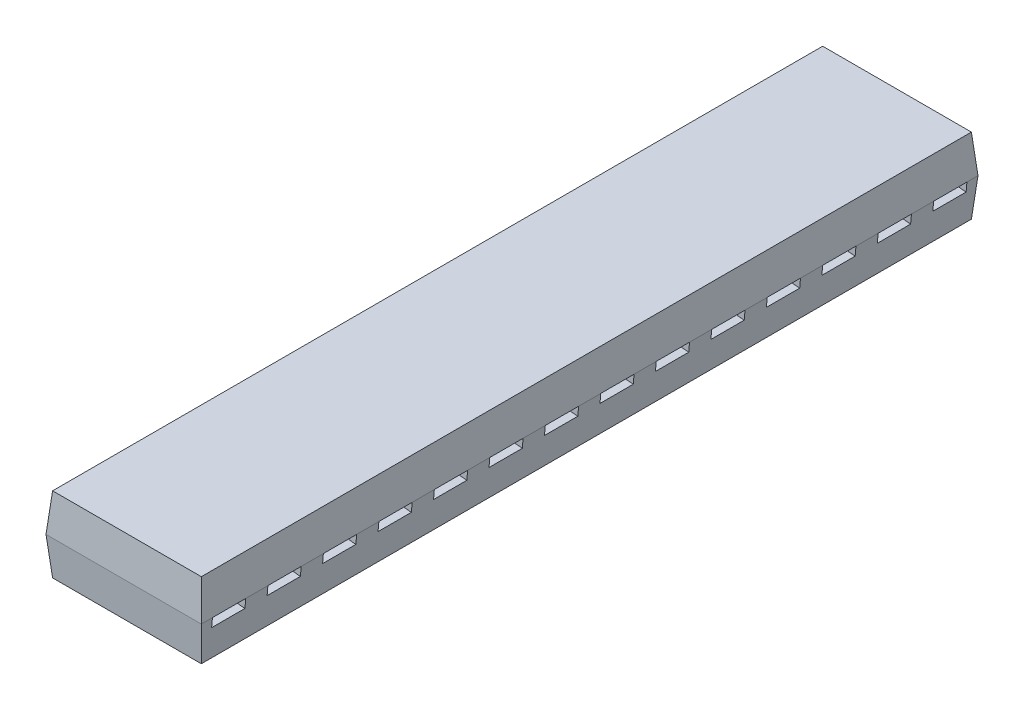
from build123d import *

# Parameters (mm, degrees)
SKETCH1_W                     = 7
SKETCH1_H                     = 35
BOSS_EXTRUDE1_DEPTH           = 1.7
BOSS_EXTRUDE1_TAPER           = 5
BOSS_EXTRUDE1_OTHER_WAY_DEPTH = 1.7
BOSS_EXTRUDE1_OTHER_WAY_TAPER = 5
SKETCH2_W                     = 1.5
SKETCH2_H                     = 0.41
CUT_EXTRUDE1_DEPTH            = 1.7


with BuildPart() as part:
    # Sketch1 → Boss-Extrude1 (new body)
    with BuildSketch(Plane(origin=(0, 0, 0), x_dir=(1, 0, 0), z_dir=(0, 1, 0))):
        with Locations((3.5, 17.5)):
            Rectangle(SKETCH1_W, SKETCH1_H)
    extrude(amount=BOSS_EXTRUDE1_DEPTH, taper=BOSS_EXTRUDE1_TAPER)

    # Sketch1 → Boss-Extrude1 other way (add)
    with BuildSketch(Plane(origin=(0, 0, 0), x_dir=(1, 0, 0), z_dir=(0, 1, 0))):
        with Locations((3.5, 17.5)):
            Rectangle(SKETCH1_W, SKETCH1_H)
    extrude(amount=-BOSS_EXTRUDE1_OTHER_WAY_DEPTH, taper=BOSS_EXTRUDE1_OTHER_WAY_TAPER)

    # Sketch2 → Cut-Extrude1 (cut)
    with BuildSketch(Plane(origin=(6.946827136, -0.607768622, 0), x_dir=(0, 0, -1), z_dir=(0.9961946980917457, -0.08715574274765837, 0))):
        with Locations((1.25, 0.405090199)):
            Rectangle(SKETCH2_W, SKETCH2_H)
        with Locations((3.75, 0.405090199)):
            Rectangle(SKETCH2_W, SKETCH2_H)
        with Locations((6.25, 0.405090199)):
            Rectangle(SKETCH2_W, SKETCH2_H)
        with Locations((8.75, 0.405090199)):
            Rectangle(SKETCH2_W, SKETCH2_H)
        with Locations((11.25, 0.405090199)):
            Rectangle(SKETCH2_W, SKETCH2_H)
        with Locations((13.75, 0.405090199)):
            Rectangle(SKETCH2_W, SKETCH2_H)
        with Locations((16.25, 0.405090199)):
            Rectangle(SKETCH2_W, SKETCH2_H)
        with Locations((18.75, 0.405090199)):
            Rectangle(SKETCH2_W, SKETCH2_H)
        with Locations((21.25, 0.405090199)):
            Rectangle(SKETCH2_W, SKETCH2_H)
        with Locations((23.75, 0.405090199)):
            Rectangle(SKETCH2_W, SKETCH2_H)
        with Locations((26.25, 0.405090199)):
            Rectangle(SKETCH2_W, SKETCH2_H)
        with Locations((28.75, 0.405090199)):
            Rectangle(SKETCH2_W, SKETCH2_H)
        with Locations((31.25, 0.405090199)):
            Rectangle(SKETCH2_W, SKETCH2_H)
        with Locations((33.75, 0.405090199)):
            Rectangle(SKETCH2_W, SKETCH2_H)
    cut_extrude1 = extrude(amount=-CUT_EXTRUDE1_DEPTH, mode=Mode.SUBTRACT)

    # Mirror1: Cut-Extrude1 across plane
    add(cut_extrude1.mirror(Plane(origin=(3.5, 0, 0), x_dir=(0, 0, 1), z_dir=(1, 0, 0))), mode=Mode.SUBTRACT)


solid = part.part
